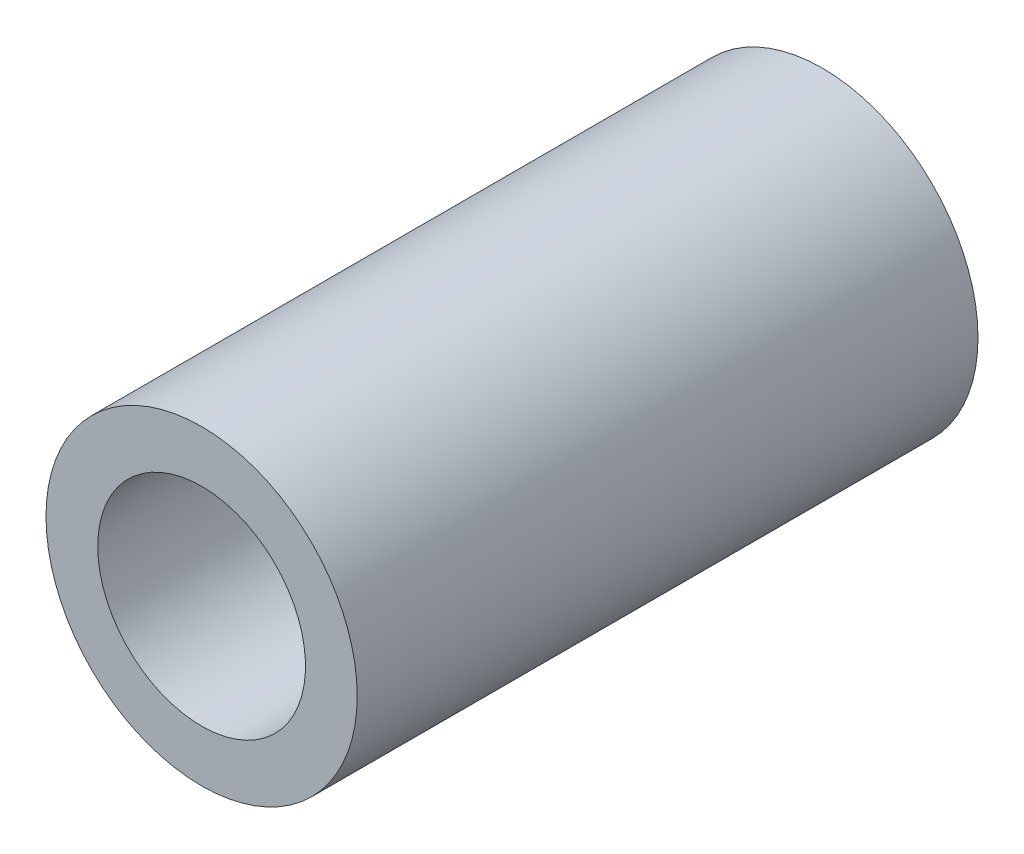
from build123d import *

# Parameters (mm, degrees)
SKETCH1_R      = 9.5504
SKETCH1_R_2    = 6.3754
EXTRUDE1_DEPTH = 19.05


with BuildPart() as part:
    # Sketch1 → Extrude1 (new, symmetric)
    with BuildSketch(Plane.XY):
        with Locations(Location((0, 0, 0), (0, 0, 180))):
            Circle(SKETCH1_R)
        with Locations(Location((0, 0, 0), (0, 0, 180))):
            Circle(SKETCH1_R_2, mode=Mode.SUBTRACT)
    extrude(amount=EXTRUDE1_DEPTH, both=True)


solid = part.part
